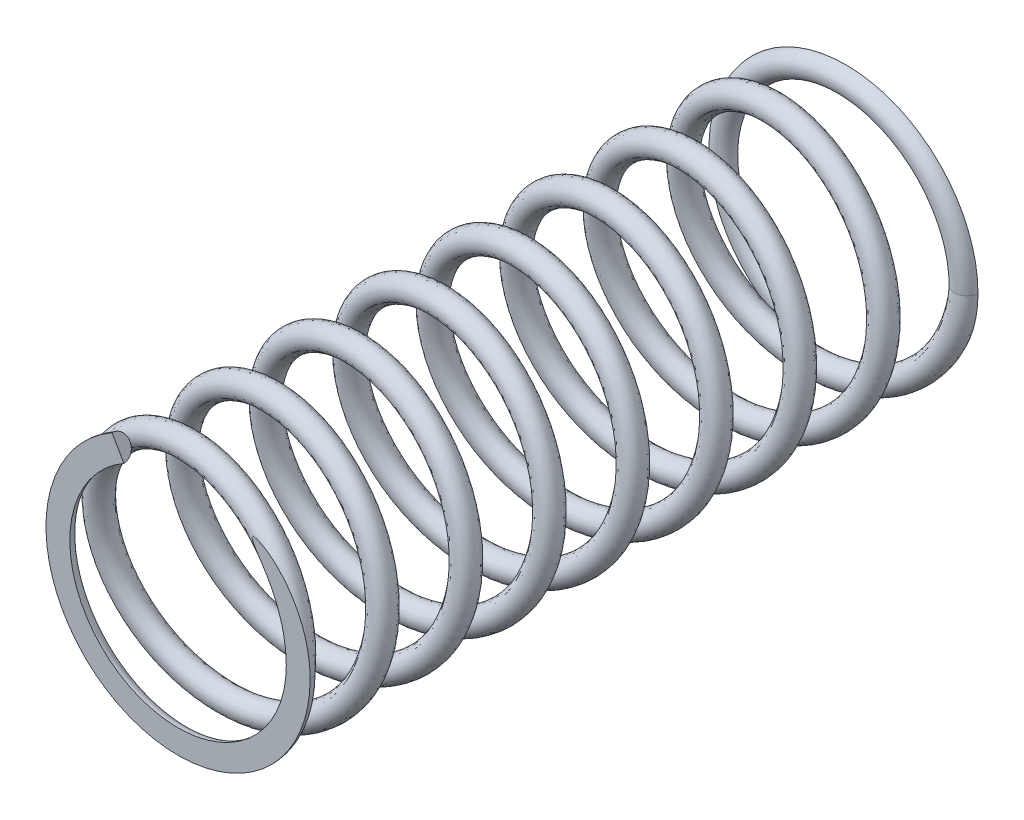
from build123d import *

# Parameters (mm, degrees)
SWEEP1_PITCH       = 13.999845
SWEEP1_HEIGHT      = 111.99876
SWEEP1_RADIUS      = 20.15
SWEEP1_PROFILE_R   = 2
SWEEP2_PROFILE_R   = 2
SKETCH41_R         = 25
CUT_EXTRUDE1_DEPTH = 119.212520214
SWEEP3_PROFILE_R   = 2
SKETCH55_R         = 25
CUT_EXTRUDE2_DEPTH = 119.212520214


with BuildPart() as part:
    # Sweep1: sweep along a helix
    with BuildLine() as sweep1_path:
        Helix(SWEEP1_PITCH, SWEEP1_HEIGHT, SWEEP1_RADIUS, center=(0, 0, 0), direction=(0, 0, 1), lefthand=True)
    # Sweep1 profile (on start of the path) → Sweep1 (sweep)
    with BuildSketch(Plane(origin=(20.15, 0, 0), x_dir=(0, -0.10990798579701415, -0.9939417662308208), z_dir=(2.0331849540850006e-13, -0.9939417662308208, 0.10990798579701415))):
        Circle(SWEEP1_PROFILE_R)
    sweep(path=sweep1_path.line, is_frenet=True)

    # Sweep2: sweep along a path in Sketch10
    with BuildLine(Plane.XY.offset(111.99876)) as sweep2_path:
        ThreePointArc((20.15, 0), (-10.075, -17.450411886), (-10.075, 17.450411886))
    # Sweep2 profile (on start of the path) → Sweep2 (sweep)
    with BuildSketch(Plane(origin=(20.15, 0, 111.99876), x_dir=(-1, 0, 0), z_dir=(0, -1, 0))):
        Circle(SWEEP2_PROFILE_R)
    sweep(path=sweep2_path.line)

    # Sketch41 → Cut-Extrude1 (cut, through all)
    with BuildSketch(Plane.XY.offset(111.99876)):
        Circle(SKETCH41_R)
    extrude(amount=CUT_EXTRUDE1_DEPTH, mode=Mode.SUBTRACT)

    # Sweep3: sweep along a path in Sketch42
    with BuildLine(Plane.XY) as sweep3_path:
        ThreePointArc((20.15, 0), (-10.075, 17.450411886), (-10.075, -17.450411886))
    # Sweep3 profile (on start of the path) → Sweep3 (sweep)
    with BuildSketch(Plane(origin=(20.15, 0, 0), x_dir=(1, 0, 0), z_dir=(0, 1, 0))):
        Circle(SWEEP3_PROFILE_R)
    sweep(path=sweep3_path.line)

    # Sketch55 → Cut-Extrude2 (cut, through all)
    with BuildSketch(Plane.XY):
        Circle(SKETCH55_R)
    extrude(amount=-CUT_EXTRUDE2_DEPTH, mode=Mode.SUBTRACT)


solid = part.part
